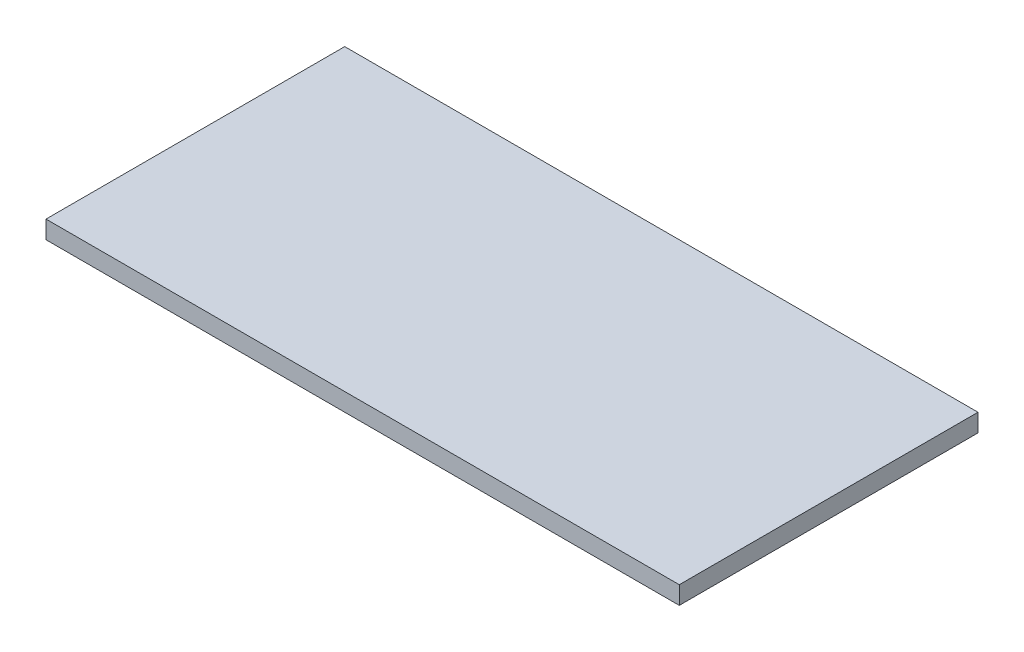
from build123d import *

# Parameters (mm, degrees)
SKETCH1_W           = 212
SKETCH1_H           = 100
BOSS_EXTRUDE1_DEPTH = 6


with BuildPart() as part:
    # Sketch1 → Boss-Extrude1 (new body)
    with BuildSketch(Plane(origin=(0, 0, 0), x_dir=(1, 0, 0), z_dir=(0, 1, 0))):
        with Locations((106, 50)):
            Rectangle(SKETCH1_W, SKETCH1_H)
    extrude(amount=BOSS_EXTRUDE1_DEPTH)


solid = part.part
